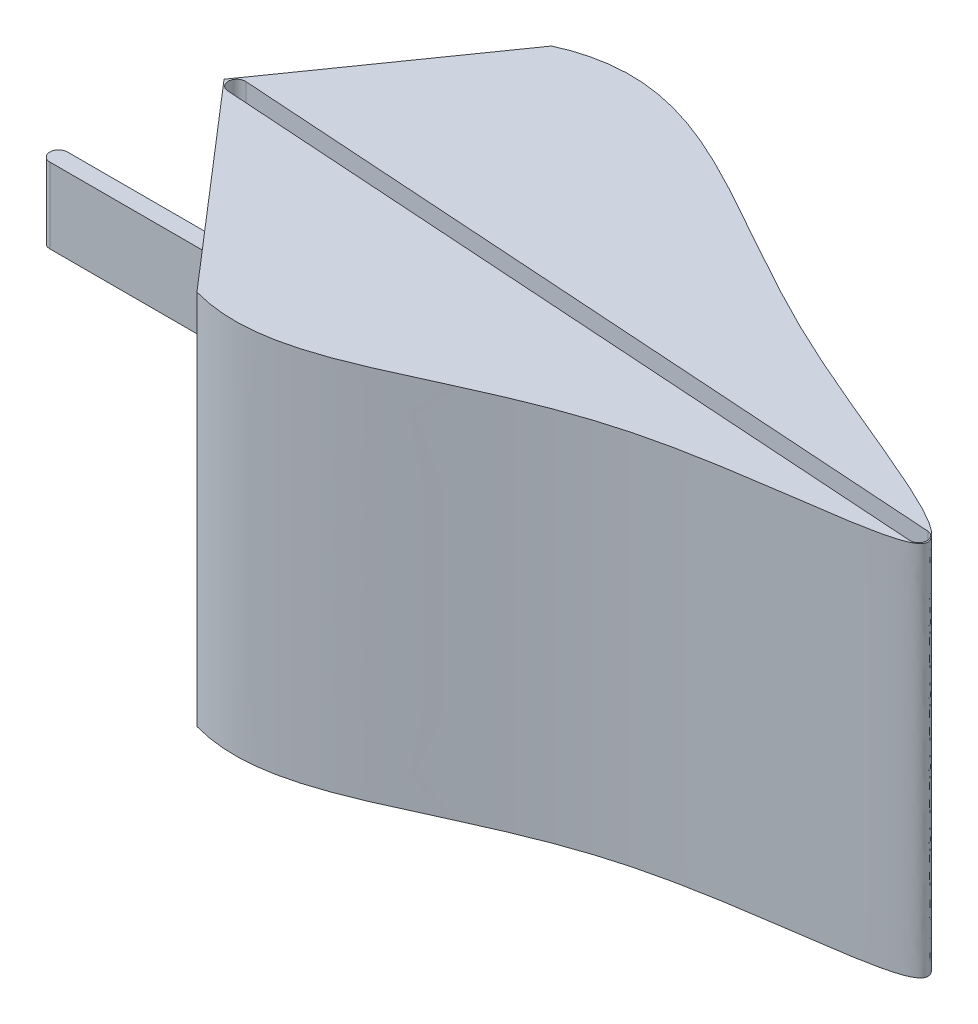
from build123d import *

# Parameters (mm, degrees)
BOSS_EXTRUDE3_DEPTH      = 5
CUT_EXTRUDE1_DEPTH       = 1
BOSS_EXTRUDE5_DEPTH      = 0.5
BOSS_EXTRUDE5_DEPTH_BACK = 0.5


with BuildPart() as part:
    # Sketch6 → Boss-Extrude3 (new body)
    with BuildSketch(Plane(origin=(0, 0, 0), x_dir=(1, 0, 0), z_dir=(0, 1, 0))):
        with BuildLine():
            add(Edge.make_bspline(
                [(-1.256039449, 1.841417614), (0.233794125, 2.519006442), (2.510618748, 0.36770734), (8.764915625, -1.635448525), (2.584650338, -1.772742295), (0.624065698, -3.740030696), (-0.780587173, -3.3480934)],
                knots=[0.133444497, 0.133444497, 0.133444497, 0.133444497, 0.358406605, 0.511014145, 0.653251299, 0.851650171, 0.851650171, 0.851650171, 0.851650171], degree=3))
            Line((-1.256039449, 1.841417614), (-3.050385484, -0.717530514))
            Line((-3.050385484, -0.717530514), (-0.780587173, -3.3480934))
        make_face()
    extrude(amount=BOSS_EXTRUDE3_DEPTH)

    # Sketch7 → Cut-Extrude1 (cut)
    with BuildSketch(Plane(origin=(0, 5, 0), x_dir=(1, 0, 0), z_dir=(0, 1, 0))):
        with BuildLine():
            Line((-2.877871497, -0.599374404), (6.826819959, -1.242030763))
            ThreePointArc((6.826819959, -1.242030763), (6.932983359, -1.363251838), (6.811762285, -1.469415239))
            Line((6.811762285, -1.469415239), (-2.892929171, -0.826758879))
            ThreePointArc((-2.892929171, -0.826758879), (-2.999092572, -0.705537804), (-2.877871497, -0.599374404))
        make_face()
    extrude(amount=-CUT_EXTRUDE1_DEPTH, mode=Mode.SUBTRACT)

    # Sketch9 → Boss-Extrude5 (add, two sides: drawn at the far end of the back side and taken through both)
    with BuildSketch(Plane(origin=(0, 2.5, 0), x_dir=(1, 0, 0), z_dir=(0, 1, 0)).offset(-BOSS_EXTRUDE5_DEPTH_BACK)):
        with BuildLine():
            Line((-2.985816802, -0.828326194), (-5.254284336, -0.828326194))
            ThreePointArc((-5.254284336, -0.828326194), (-5.370682329, -0.711928202), (-5.254284336, -0.59553021))
            Line((-5.254284336, -0.59553021), (-2.985816802, -0.59553021))
            ThreePointArc((-2.985816802, -0.59553021), (-2.86941881, -0.711928202), (-2.985816802, -0.828326194))
        make_face()
    extrude(amount=BOSS_EXTRUDE5_DEPTH + BOSS_EXTRUDE5_DEPTH_BACK)


solid = part.part
